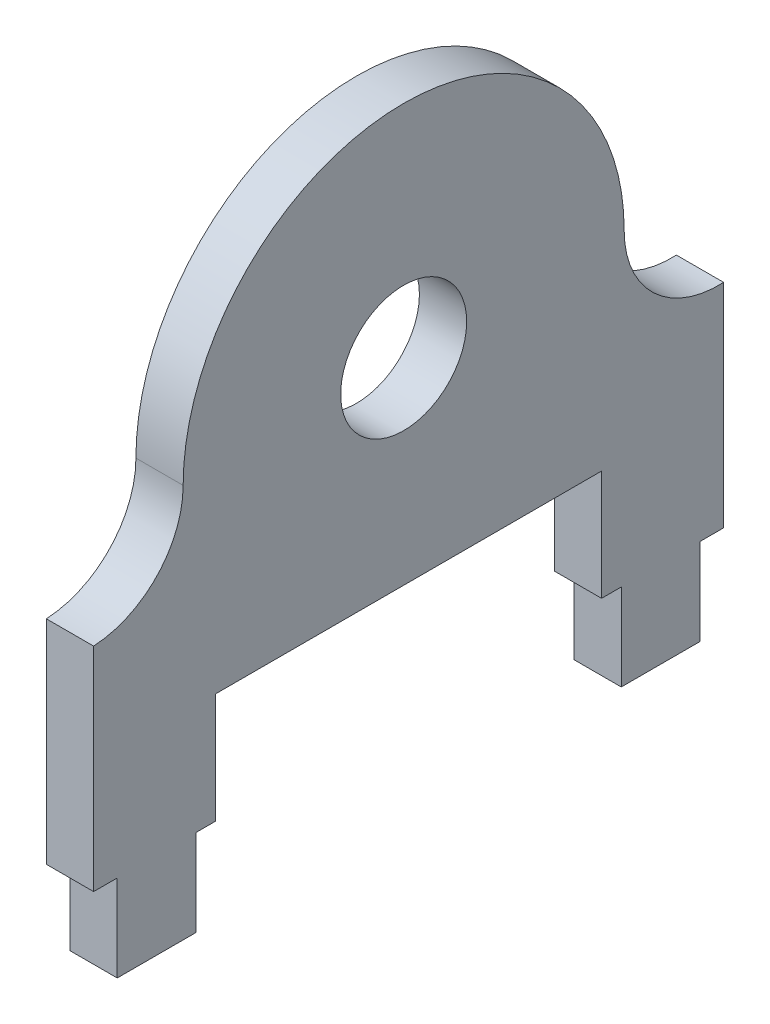
from build123d import *

# Parameters (mm, degrees)
SKETCH3_R           = 4
BOSS_EXTRUDE1_DEPTH = 3


with BuildPart() as part:
    # Sketch3 → Boss-Extrude1 (new body)
    with BuildSketch(Plane(origin=(0, 0, 0), x_dir=(0, 0, -1), z_dir=(1, 0, 0))):
        with BuildLine():
            Line((-16.828358209, -0.167910448), (-16.828358209, -13.667910448))
            Line((-16.828358209, -13.667910448), (-15.328358209, -13.667910448))
            Line((-15.328358209, -13.667910448), (-15.328358209, -19.167910448))
            Line((-15.328358209, -19.167910448), (-10.328358209, -19.167910448))
            Line((-10.328358209, -19.167910448), (-10.328358209, -13.667910448))
            Line((-10.328358209, -13.667910448), (-9.078358209, -13.667910448))
            Line((-9.078358209, -13.667910448), (-9.078358209, -6.667910448))
            Line((-9.078358209, -6.667910448), (15.421641791, -6.667910448))
            Line((15.421641791, -6.667910448), (15.421641791, -13.667910448))
            Line((15.421641791, -13.667910448), (16.671641791, -13.667910448))
            Line((16.671641791, -13.667910448), (16.671641791, -19.167910448))
            Line((16.671641791, -19.167910448), (21.671641791, -19.167910448))
            Line((21.671641791, -19.167910448), (21.671641791, -13.667910448))
            Line((21.671641791, -13.667910448), (23.171641791, -13.667910448))
            Line((23.171641791, -13.667910448), (23.171641791, -0.167910448))
            ThreePointArc((23.171641791, -0.167910448), (18.726397941, 1.476700456), (16.856765964, 5.832089552))
            ThreePointArc((16.856765964, 5.832089552), (2.853872221, 19.832089253), (-11.14323284, 5.826302065))
            ThreePointArc((-11.14323284, 5.826302065), (-12.789836747, 1.694905763), (-16.828358209, -0.167910448))
        make_face()
        with Locations((2.856765964, 5.832089552)):
            Circle(SKETCH3_R, mode=Mode.SUBTRACT)
    extrude(amount=BOSS_EXTRUDE1_DEPTH)


solid = part.part
